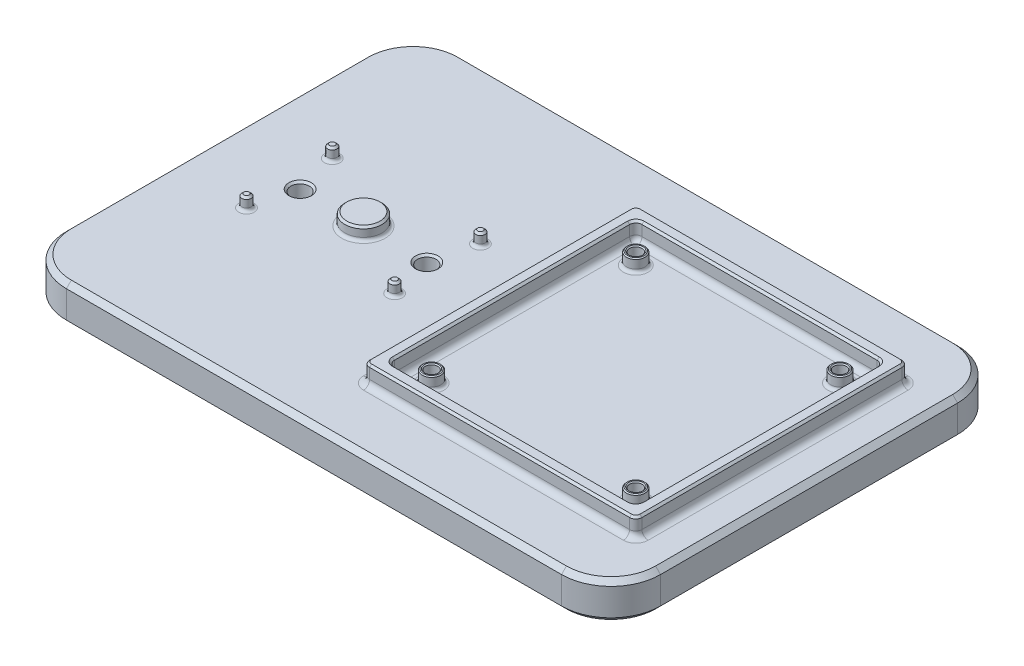
from build123d import *

# Parameters (mm, degrees)
SKETCH2_W           = 152.4
SKETCH2_H           = 101.6
SKETCH2_R           = 1.5875
SKETCH2_R_2         = 2.38125
BOSS_EXTRUDE1_DEPTH = 9.525
SKETCH3_R           = 4.7625
SKETCH3_R_2         = 1.190625
SKETCH3_R_3         = 2.38125
SKETCH3_R_4         = 1.5875
BOSS_EXTRUDE2_DEPTH = 3.175
SKETCH5_W           = 69.85
SKETCH5_H           = 69.85
SKETCH5_W_2         = 63.5
SKETCH5_H_2         = 63.5
BOSS_EXTRUDE4_DEPTH = 4.7625
CUT_EXTRUDE1_DEPTH  = 3.175
CUT_EXTRUDE2_DEPTH  = 2.38125
FILLET2_R           = 12.7
FILLET4_R           = 1.5875
FILLET5_R           = 0.79375
FILLET6_R           = 0.79375
CHAMFER1_SIZE       = 1.27
CHAMFER2_SIZE       = 0.508
CHAMFER3_SIZE       = 0.254


with BuildPart() as part:
    # Sketch2 → Boss-Extrude1 (new body)
    with BuildSketch(Plane(origin=(0, 0, 0), x_dir=(1, 0, 0), z_dir=(0, 1, 0))):
        Rectangle(SKETCH2_W, SKETCH2_H)
        with Locations(Location((57.94375, 26.19375, 0), (0, 0, 90))):
            Circle(SKETCH2_R, mode=Mode.SUBTRACT)
        with Locations(Location((57.94375, -26.19375, 0), (0, 0, 90))):
            Circle(SKETCH2_R, mode=Mode.SUBTRACT)
        with Locations(Location((5.55625, -26.19375, 0), (0, 0, 90))):
            Circle(SKETCH2_R, mode=Mode.SUBTRACT)
        with Locations(Location((5.55625, 26.19375, 0), (0, 0, 90))):
            Circle(SKETCH2_R, mode=Mode.SUBTRACT)
        with Locations(Location((-54.3499929, 0, 0), (0, 0, 90))):
            Circle(SKETCH2_R_2, mode=Mode.SUBTRACT)
        with Locations(Location((-21.8500071, 0, 0), (0, 0, 90))):
            Circle(SKETCH2_R_2, mode=Mode.SUBTRACT)
    extrude(amount=BOSS_EXTRUDE1_DEPTH)

    # Sketch3 → Boss-Extrude2 (add)
    # profile 1 of 9: a face of its own
    with BuildSketch(Plane(origin=(0, 9.525, 0), x_dir=(1, 0, 0), z_dir=(0, 1, 0))):
        with Locations(Location((-38.1, 0, 0), (0, 0, 90))):
            Circle(SKETCH3_R)
    # profile 2 of 9: a face of its own
    with BuildSketch(Plane(origin=(0, 9.525, 0), x_dir=(1, 0, 0), z_dir=(0, 1, 0))):
        with Locations(Location((-57.1000128, 11.0000034, 0), (0, 0, 90))):
            Circle(SKETCH3_R_2)
    # profile 3 of 9: a face of its own
    with BuildSketch(Plane(origin=(0, 9.525, 0), x_dir=(1, 0, 0), z_dir=(0, 1, 0))):
        with Locations(Location((-19.0999872, 11.0000034, 0), (0, 0, 90))):
            Circle(SKETCH3_R_2)
    # profile 4 of 9: a face of its own
    with BuildSketch(Plane(origin=(0, 9.525, 0), x_dir=(1, 0, 0), z_dir=(0, 1, 0))):
        with Locations(Location((-57.1000128, -11.0000034, 0), (0, 0, 90))):
            Circle(SKETCH3_R_2)
    # profile 5 of 9: a face of its own
    with BuildSketch(Plane(origin=(0, 9.525, 0), x_dir=(1, 0, 0), z_dir=(0, 1, 0))):
        with Locations(Location((-19.0999872, -11.0000034, 0), (0, 0, 90))):
            Circle(SKETCH3_R_2)
    # profile 6 of 9: a face of its own
    with BuildSketch(Plane(origin=(0, 9.525, 0), x_dir=(1, 0, 0), z_dir=(0, 1, 0))):
        with Locations(Location((5.55625, 26.19375, 0), (0, 0, 90))):
            Circle(SKETCH3_R_3)
        with Locations(Location((5.55625, 26.19375, 0), (0, 0, 90))):
            Circle(SKETCH3_R_4, mode=Mode.SUBTRACT)
    # profile 7 of 9: a face of its own
    with BuildSketch(Plane(origin=(0, 9.525, 0), x_dir=(1, 0, 0), z_dir=(0, 1, 0))):
        with Locations(Location((57.94375, 26.19375, 0), (0, 0, 90))):
            Circle(SKETCH3_R_3)
        with Locations(Location((57.94375, 26.19375, 0), (0, 0, 90))):
            Circle(SKETCH3_R_4, mode=Mode.SUBTRACT)
    # profile 8 of 9: a face of its own
    with BuildSketch(Plane(origin=(0, 9.525, 0), x_dir=(1, 0, 0), z_dir=(0, 1, 0))):
        with Locations(Location((57.94375, -26.19375, 0), (0, 0, 90))):
            Circle(SKETCH3_R_3)
        with Locations(Location((57.94375, -26.19375, 0), (0, 0, 90))):
            Circle(SKETCH3_R_4, mode=Mode.SUBTRACT)
    # profile 9 of 9: a face of its own
    with BuildSketch(Plane(origin=(0, 9.525, 0), x_dir=(1, 0, 0), z_dir=(0, 1, 0))):
        with Locations(Location((5.55625, -26.19375, 0), (0, 0, 90))):
            Circle(SKETCH3_R_3)
        with Locations(Location((5.55625, -26.19375, 0), (0, 0, 90))):
            Circle(SKETCH3_R_4, mode=Mode.SUBTRACT)
    extrude(amount=BOSS_EXTRUDE2_DEPTH)

    # Sketch5 → Boss-Extrude4 (add)
    with BuildSketch(Plane(origin=(0, 9.525, 0), x_dir=(1, 0, 0), z_dir=(0, 1, 0))):
        with Locations((31.75, 0)):
            Rectangle(SKETCH5_W, SKETCH5_H)
        with Locations((31.75, 0)):
            Rectangle(SKETCH5_W_2, SKETCH5_H_2, mode=Mode.SUBTRACT)
    extrude(amount=BOSS_EXTRUDE4_DEPTH)

    # Sketch6 → Cut-Extrude1 (cut)
    with BuildSketch(Plane.XZ):
        Polygon((-51.600362243, 4.7625), (-57.099623557, 4.7625), (-59.849254214, 0), (-57.099623557, -4.7625), (-51.600362243, -4.7625), (-48.850731586, 0), align=None)
        Polygon((-19.100376443, 4.7625), (-24.599637757, 4.7625), (-27.349268414, 0), (-24.599637757, -4.7625), (-19.100376443, -4.7625), (-16.350745786, 0), align=None)
    extrude(amount=-CUT_EXTRUDE1_DEPTH, mode=Mode.SUBTRACT)

    # Sketch7 → Cut-Extrude2 (cut)
    with BuildSketch(Plane.XZ):
        Polygon((7.425998847, 29.43225), (3.686501153, 29.43225), (1.816752306, 26.19375), (3.686501153, 22.95525), (7.425998847, 22.95525), (9.295747694, 26.19375), align=None)
        Polygon((59.813498847, 29.43225), (56.074001153, 29.43225), (54.204252306, 26.19375), (56.074001153, 22.95525), (59.813498847, 22.95525), (61.683247694, 26.19375), align=None)
        Polygon((7.425998847, -22.95525), (3.686501153, -22.95525), (1.816752306, -26.19375), (3.686501153, -29.43225), (7.425998847, -29.43225), (9.295747694, -26.19375), align=None)
        Polygon((59.813498847, -22.95525), (56.074001153, -22.95525), (54.204252306, -26.19375), (56.074001153, -29.43225), (59.813498847, -29.43225), (61.683247694, -26.19375), align=None)
    extrude(amount=-CUT_EXTRUDE2_DEPTH, mode=Mode.SUBTRACT)

    # Fillet2
    fillet2_edges = [part.edges().sort_by_distance(p)[0] for p in [
        (76.2, 4.7625, 50.8),
        (-76.2, 4.7625, 50.8),
        (-76.2, 4.7625, -50.8),
        (76.2, 4.7625, -50.8),
    ]]
    fillet(fillet2_edges, radius=FILLET2_R)

    # Fillet4
    fillet4_edges = [part.edges().sort_by_distance(p)[0] for p in [
        (31.75, 9.525, 31.75),
        (63.5, 9.525, 0),
        (31.75, 9.525, -31.75),
        (0, 9.525, 0),
        (-3.175, 9.525, 0),
        (-3.175, 11.90625, -34.925),
        (31.75, 9.525, 34.925),
        (-3.175, 11.90625, 34.925),
        (66.675, 9.525, 0),
        (66.675, 11.90625, 34.925),
        (31.75, 9.525, -34.925),
        (66.675, 11.90625, -34.925),
        (63.5, 11.90625, -31.75),
        (0, 11.90625, -31.75),
        (0, 11.90625, 31.75),
        (63.5, 11.90625, 31.75),
    ]]
    fillet(fillet4_edges, radius=FILLET4_R)

    # Fillet5
    fillet5_edges = [part.edges().sort_by_distance(p)[0] for p in [
        (-38.1, 9.525, 4.7625),
        (5.55625, 9.525, -23.8125),
        (57.94375, 9.525, -23.8125),
        (57.94375, 9.525, 28.575),
        (5.55625, 9.525, 28.575),
    ]]
    fillet(fillet5_edges, radius=FILLET5_R)

    # Fillet6
    fillet6_edges = [part.edges().sort_by_distance(p)[0] for p in [
        (-50.225546914, 3.175, 2.38125),
        (-51.600362243, 1.5875, 4.7625),
        (-50.225546914, 3.175, -2.38125),
        (-48.850731586, 1.5875, 0),
        (-54.3499929, 3.175, -4.7625),
        (-51.600362243, 1.5875, -4.7625),
        (-58.474438886, 3.175, -2.38125),
        (-57.099623557, 1.5875, -4.7625),
        (-58.474438886, 3.175, 2.38125),
        (-59.849254214, 1.5875, 0),
        (-54.3499929, 3.175, 4.7625),
        (-57.099623557, 1.5875, 4.7625),
        (-17.725561114, 3.175, 2.38125),
        (-19.100376443, 1.5875, 4.7625),
        (-17.725561114, 3.175, -2.38125),
        (-16.350745786, 1.5875, 0),
        (-21.8500071, 3.175, -4.7625),
        (-19.100376443, 1.5875, -4.7625),
        (-25.974453086, 3.175, -2.38125),
        (-24.599637757, 1.5875, -4.7625),
        (-25.974453086, 3.175, 2.38125),
        (-27.349268414, 1.5875, 0),
        (-21.8500071, 3.175, 4.7625),
        (-24.599637757, 1.5875, 4.7625),
        (60.74837327, 2.38125, 27.813),
        (59.813498847, 1.190625, 29.43225),
        (60.74837327, 2.38125, 24.5745),
        (61.683247694, 1.190625, 26.19375),
        (57.94375, 2.38125, 22.95525),
        (59.813498847, 1.190625, 22.95525),
        (55.13912673, 2.38125, 24.5745),
        (56.074001153, 1.190625, 22.95525),
        (55.13912673, 2.38125, 27.813),
        (54.204252306, 1.190625, 26.19375),
        (57.94375, 2.38125, 29.43225),
        (56.074001153, 1.190625, 29.43225),
        (8.36087327, 2.38125, -24.5745),
        (7.425998847, 1.190625, -22.95525),
        (8.36087327, 2.38125, -27.813),
        (9.295747694, 1.190625, -26.19375),
        (5.55625, 2.38125, -29.43225),
        (7.425998847, 1.190625, -29.43225),
        (2.75162673, 2.38125, -27.813),
        (3.686501153, 1.190625, -29.43225),
        (2.75162673, 2.38125, -24.5745),
        (1.816752306, 1.190625, -26.19375),
        (5.55625, 2.38125, -22.95525),
        (3.686501153, 1.190625, -22.95525),
        (60.74837327, 2.38125, -24.5745),
        (59.813498847, 1.190625, -22.95525),
        (60.74837327, 2.38125, -27.813),
        (61.683247694, 1.190625, -26.19375),
        (57.94375, 2.38125, -29.43225),
        (59.813498847, 1.190625, -29.43225),
        (55.13912673, 2.38125, -27.813),
        (56.074001153, 1.190625, -29.43225),
        (55.13912673, 2.38125, -24.5745),
        (54.204252306, 1.190625, -26.19375),
        (57.94375, 2.38125, -22.95525),
        (56.074001153, 1.190625, -22.95525),
        (8.36087327, 2.38125, 27.813),
        (7.425998847, 1.190625, 29.43225),
        (8.36087327, 2.38125, 24.5745),
        (9.295747694, 1.190625, 26.19375),
        (5.55625, 2.38125, 22.95525),
        (7.425998847, 1.190625, 22.95525),
        (2.75162673, 2.38125, 24.5745),
        (3.686501153, 1.190625, 22.95525),
        (2.75162673, 2.38125, 27.813),
        (1.816752306, 1.190625, 26.19375),
        (5.55625, 2.38125, 29.43225),
        (3.686501153, 1.190625, 29.43225),
        (-57.1000128, 9.525, -9.8093784),
        (-19.0999872, 9.525, -9.8093784),
        (-57.1000128, 9.525, 12.1906284),
        (-19.0999872, 9.525, 12.1906284),
    ]]
    fillet(fillet6_edges, radius=FILLET6_R)

    # Chamfer1
    chamfer1_edges = [part.edges().sort_by_distance(p)[0] for p in [
        (76.2, 0, 0),
        (76.2, 9.525, 0),
        (0, 0, 50.8),
        (-76.2, 0, 0),
        (0, 0, -50.8),
        (-72.480256121, 0, 47.080256121),
        (72.480256121, 0, -47.080256121),
        (-72.480256121, 0, -47.080256121),
        (72.480256121, 0, 47.080256121),
        (0, 9.525, 50.8),
        (0, 9.525, -50.8),
        (-76.2, 9.525, 0),
        (-72.480256121, 9.525, 47.080256121),
        (72.480256121, 9.525, -47.080256121),
        (-72.480256121, 9.525, -47.080256121),
        (72.480256121, 9.525, 47.080256121),
    ]]
    chamfer(chamfer1_edges, length=CHAMFER1_SIZE)

    # Chamfer2
    chamfer2_edges = [part.edges().sort_by_distance(p)[0] for p in [
        (-54.3499929, 3.175, 2.38125),
        (-21.8500071, 3.175, 2.38125),
        (-3.175, 14.2875, 0),
        (31.75, 14.2875, -34.925),
        (31.75, 14.2875, 34.925),
        (66.675, 14.2875, 0),
        (63.5, 14.2875, 0),
        (31.75, 14.2875, 31.75),
        (0, 14.2875, 0),
        (31.75, 14.2875, -31.75),
        (-2.710032015, 14.2875, 34.460032015),
        (66.210032015, 14.2875, 34.460032015),
        (66.210032015, 14.2875, -34.460032015),
        (-2.710032015, 14.2875, -34.460032015),
        (-54.3499929, 9.525, 2.38125),
        (63.035032015, 14.2875, -31.285032015),
        (63.035032015, 14.2875, 31.285032015),
        (0.464967985, 14.2875, -31.285032015),
        (0.464967985, 14.2875, 31.285032015),
        (-21.8500071, 9.525, 2.38125),
        (-17.725561114, 0, -2.38125),
        (-21.8500071, 0, -4.7625),
        (-25.974453086, 0, -2.38125),
        (-25.974453086, 0, 2.38125),
        (-21.8500071, 0, 4.7625),
        (-38.1, 12.7, 4.7625),
        (-17.725561114, 0, 2.38125),
        (-50.225546914, 0, -2.38125),
        (-54.3499929, 0, -4.7625),
        (-58.474438886, 0, -2.38125),
        (-58.474438886, 0, 2.38125),
        (-54.3499929, 0, 4.7625),
        (-50.225546914, 0, 2.38125),
        (-57.1000128, 12.7, -9.8093784),
        (-19.161773219, 0, -4.656157664),
        (-24.538240981, 0, -4.656157664),
        (-27.226474862, 0, 0),
        (-24.538240981, 0, 4.656157664),
        (-19.161773219, 0, 4.656157664),
        (-16.473539338, 0, 0),
        (-51.661759019, 0, -4.656157664),
        (-57.038226781, 0, -4.656157664),
        (-59.726460662, 0, 0),
        (-57.038226781, 0, 4.656157664),
        (-51.661759019, 0, 4.656157664),
        (-48.973525138, 0, 0),
        (-19.0999872, 12.7, -9.8093784),
        (-57.1000128, 12.7, 12.1906284),
        (-19.0999872, 12.7, 12.1906284),
    ]]
    chamfer(chamfer2_edges, length=CHAMFER2_SIZE)

    # Chamfer3
    chamfer3_edges = [part.edges().sort_by_distance(p)[0] for p in [
        (57.94375, 2.38125, 27.78125),
        (5.55625, 2.38125, -24.60625),
        (57.94375, 2.38125, -24.60625),
        (5.55625, 2.38125, 27.78125),
        (8.36087327, 0, -27.813),
        (5.55625, 0, -29.43225),
        (2.75162673, 0, -27.813),
        (2.75162673, 0, -24.5745),
        (5.55625, 0, -22.95525),
        (8.36087327, 0, -24.5745),
        (60.74837327, 0, -27.813),
        (57.94375, 0, -29.43225),
        (55.13912673, 0, -27.813),
        (55.13912673, 0, -24.5745),
        (57.94375, 0, -22.95525),
        (60.74837327, 0, -24.5745),
        (60.74837327, 0, 24.5745),
        (57.94375, 0, 22.95525),
        (55.13912673, 0, 24.5745),
        (55.13912673, 0, 27.813),
        (57.94375, 0, 29.43225),
        (60.74837327, 0, 27.813),
        (8.36087327, 0, 27.813),
        (8.36087327, 0, 24.5745),
        (2.75162673, 0, 24.5745),
        (2.75162673, 0, 27.813),
        (5.55625, 0, 29.43225),
        (5.55625, 0, 22.95525),
        (7.364602071, 0, -29.325907664),
        (3.747897929, 0, -29.325907664),
        (1.939545859, 0, -26.19375),
        (3.747897929, 0, -23.061592336),
        (7.364602071, 0, -23.061592336),
        (9.172954141, 0, -26.19375),
        (59.752102071, 0, -29.325907664),
        (56.135397929, 0, -29.325907664),
        (54.327045859, 0, -26.19375),
        (56.135397929, 0, -23.061592336),
        (59.752102071, 0, -23.061592336),
        (61.560454141, 0, -26.19375),
        (59.752102071, 0, 23.061592336),
        (56.135397929, 0, 23.061592336),
        (54.327045859, 0, 26.19375),
        (56.135397929, 0, 29.325907664),
        (59.752102071, 0, 29.325907664),
        (61.560454141, 0, 26.19375),
        (9.172954141, 0, 26.19375),
        (1.939545859, 0, 26.19375),
        (3.747897929, 0, 29.325907664),
        (7.364602071, 0, 29.325907664),
        (7.364602071, 0, 23.061592336),
        (3.747897929, 0, 23.061592336),
        (5.55625, 12.7, -23.8125),
        (5.55625, 12.7, -24.60625),
        (57.94375, 12.7, -23.8125),
        (57.94375, 12.7, -24.60625),
        (57.94375, 12.7, 28.575),
        (57.94375, 12.7, 27.78125),
        (5.55625, 12.7, 28.575),
        (5.55625, 12.7, 27.78125),
    ]]
    chamfer(chamfer3_edges, length=CHAMFER3_SIZE)


solid = part.part
